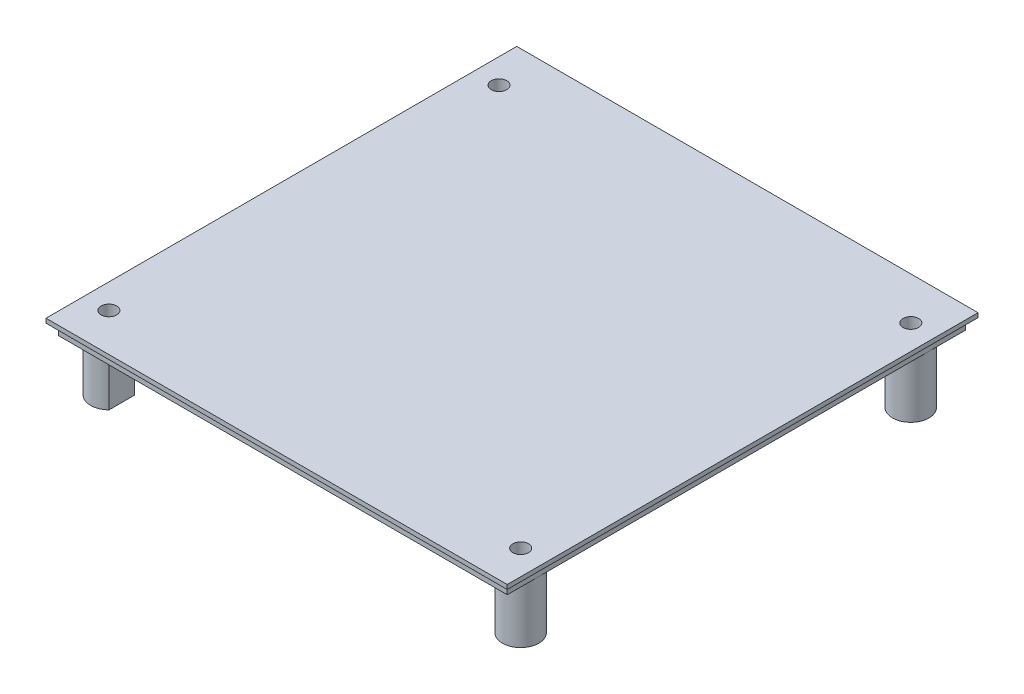
from build123d import *

# Parameters (mm, degrees)
SKETCH_1_W          = 106.4
SKETCH_1_H          = 108.6
EXTRUDE_1_DEPTH     = 1
SKETCH_2_W          = 103.5
SKETCH_2_H          = 105.7
SKETCH_2_W_2        = 102.1
SKETCH_2_H_2        = 104.3
EXTRUDE_2_DEPTH     = 2.5
SKETCH_4_R          = 1.8
CUT_EXTRUDE_1_DEPTH = 77.098488815
SKETCH_13_R         = 4.2
SKETCH_13_R_2       = 1.8
EXTRUDE_8_DEPTH     = 15.89
SKETCH_14_W         = 89
SKETCH_14_H         = 101.449206074
CUT_EXTRUDE_6_DEPTH = 15.89


with BuildPart() as part:
    # 草图1 → 凸台-拉伸1 (new body)
    with BuildSketch(Plane(origin=(0, 0, 0), x_dir=(1, 0, 0), z_dir=(0, 1, 0))):
        Rectangle(SKETCH_1_W, SKETCH_1_H)
    extrude(amount=EXTRUDE_1_DEPTH)

    # 草图2 → 凸台-拉伸2 (add)
    with BuildSketch(Plane.XZ):
        Rectangle(SKETCH_2_W, SKETCH_2_H)
        Rectangle(SKETCH_2_W_2, SKETCH_2_H_2, mode=Mode.SUBTRACT)
    extrude(amount=EXTRUDE_2_DEPTH)

    # 草图4 → 切除-拉伸1 (cut, through all)
    with BuildSketch(Plane(origin=(0, 1, 0), x_dir=(1, 0, 0), z_dir=(0, 1, 0))):
        with Locations(Location((47.5, 44.5, 0), (0, 0, 270))):
            Circle(SKETCH_4_R)
        with Locations(Location((-47.5, 44.5, 0), (0, 0, 270))):
            Circle(SKETCH_4_R)
        with Locations(Location((-47.5, -45.5, 0), (0, 0, 270))):
            Circle(SKETCH_4_R)
        with Locations(Location((47.5, -45.5, 0), (0, 0, 270))):
            Circle(SKETCH_4_R)
    extrude(amount=-CUT_EXTRUDE_1_DEPTH, mode=Mode.SUBTRACT)

    # 草图13 → 凸台-拉伸8 (add)
    # profile 1 of 4: a face of its own
    with BuildSketch(Plane.XZ):
        with Locations(Location((-47.5, 45.5, 0), (0, 0, 147.697454791))):
            Circle(SKETCH_13_R)
        with Locations(Location((-47.5, 45.5, 0), (0, 0, 90))):
            Circle(SKETCH_13_R_2, mode=Mode.SUBTRACT)
    # profile 2 of 4: a face of its own
    with BuildSketch(Plane.XZ):
        with Locations(Location((47.5, 45.5, 0), (0, 0, 32.302545209))):
            Circle(SKETCH_13_R)
        with Locations(Location((47.5, 45.5, 0), (0, 0, 90))):
            Circle(SKETCH_13_R_2, mode=Mode.SUBTRACT)
    # profile 3 of 4: a face of its own
    with BuildSketch(Plane.XZ):
        with Locations(Location((-47.5, -44.5, 0), (0, 0, 147.697454791))):
            Circle(SKETCH_13_R)
        with Locations(Location((-47.5, -44.5, 0), (0, 0, 90))):
            Circle(SKETCH_13_R_2, mode=Mode.SUBTRACT)
    # profile 4 of 4: a face of its own
    with BuildSketch(Plane.XZ):
        with Locations(Location((47.5, -44.5, 0), (0, 0, 32.302545209))):
            Circle(SKETCH_13_R)
        with Locations(Location((47.5, -44.5, 0), (0, 0, 90))):
            Circle(SKETCH_13_R_2, mode=Mode.SUBTRACT)
    extrude(amount=EXTRUDE_8_DEPTH)

    # 草图14 → 切除-拉伸6 (cut)
    with BuildSketch(Plane.XZ.offset(15.89)):
        Rectangle(SKETCH_14_W, SKETCH_14_H)
    extrude(amount=-CUT_EXTRUDE_6_DEPTH, mode=Mode.SUBTRACT)


solid = part.part
